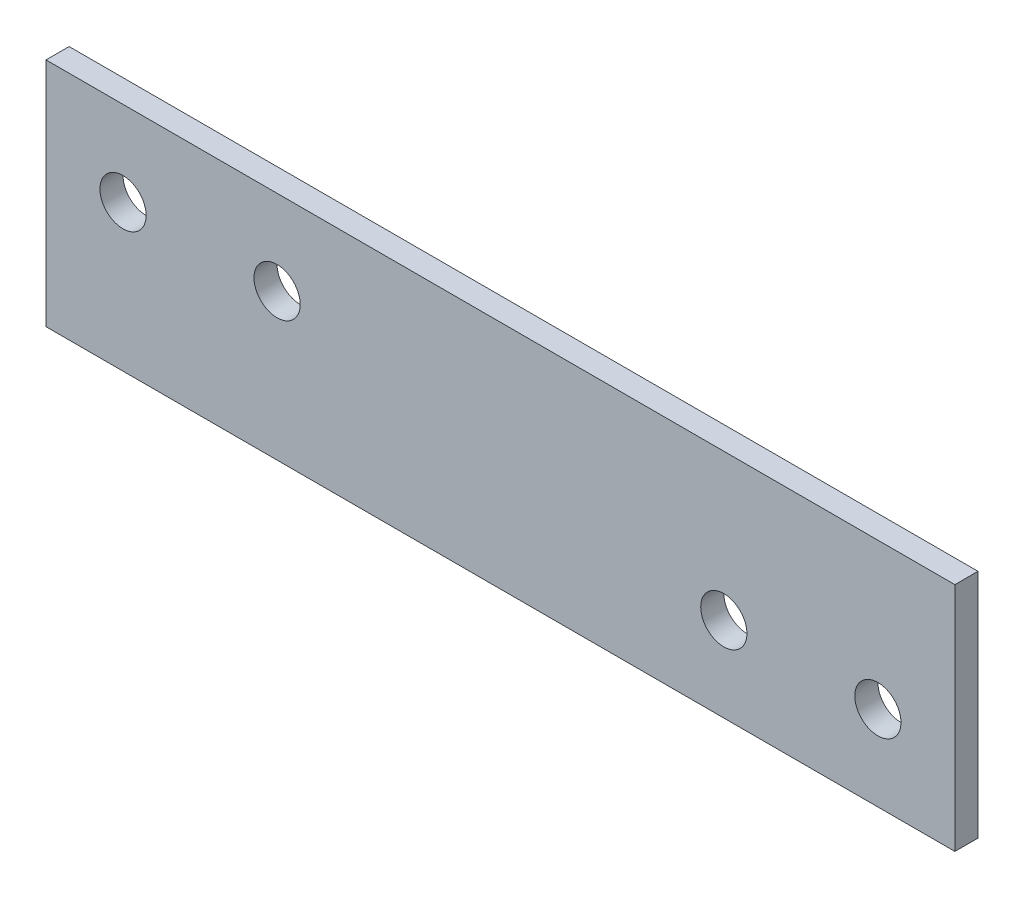
from build123d import *

# Parameters (mm, degrees)
ESQUISSE1_W      = 59
ESQUISSE1_H      = 15
EXTRUSION1_DEPTH = 1.5
ESQUISSE2_R      = 1.5
EXTRUSION2_DEPTH = 1.5


with BuildPart() as part:
    # Esquisse1 → Extrusion1 (new body)
    with BuildSketch(Plane.XY):
        with Locations((7.295787304, 4.544947368)):
            Rectangle(ESQUISSE1_W, ESQUISSE1_H)
    extrude(amount=EXTRUSION1_DEPTH)

    # Esquisse2 → Extrusion2 (cut)
    with BuildSketch(Plane(origin=(0, 0, 0), x_dir=(-1, 0, 0), z_dir=(0, 0, -1))):
        with Locations((-31.795787304, 2.544947368)):
            Circle(ESQUISSE2_R)
        with Locations((-21.795787304, 2.544947368)):
            Circle(ESQUISSE2_R)
        with Locations((17.204212696, 6.544947368)):
            Circle(ESQUISSE2_R)
        with Locations((7.204212696, 6.544947368)):
            Circle(ESQUISSE2_R)
    extrude(amount=-EXTRUSION2_DEPTH, mode=Mode.SUBTRACT)


solid = part.part
